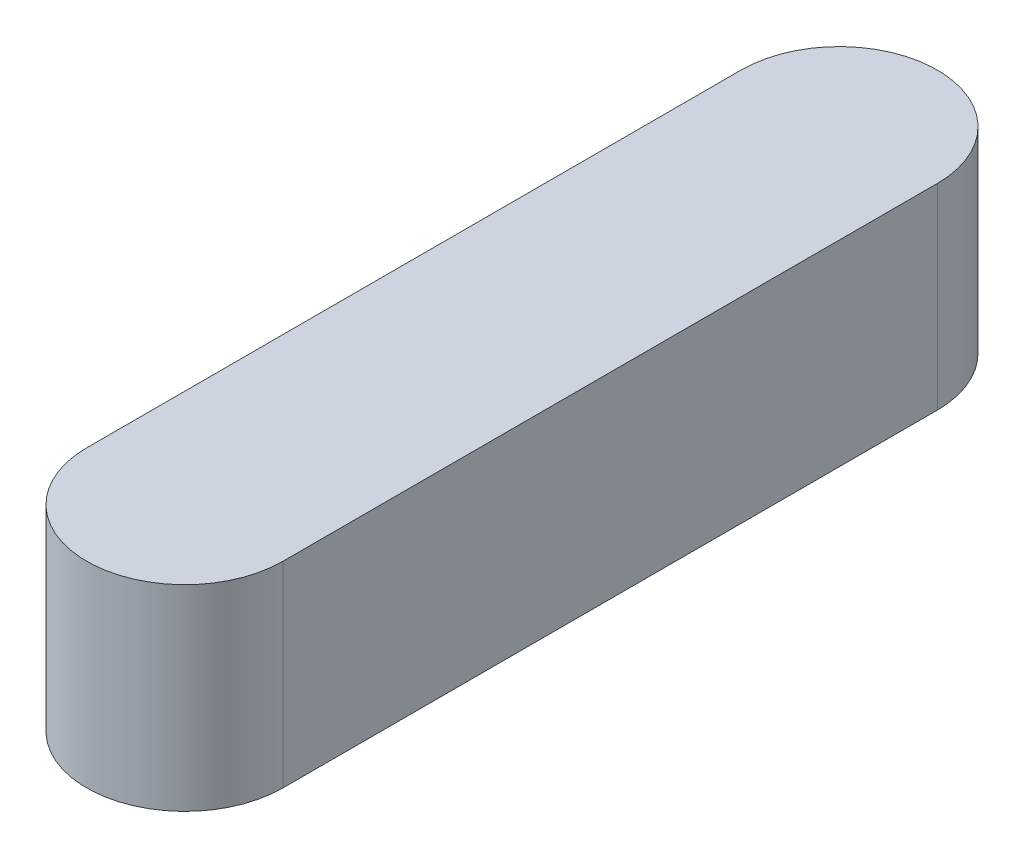
from build123d import *

# Parameters (mm, degrees)
BOSS_EXTRUDE1_DEPTH = 3


with BuildPart() as part:
    # Sketch1 → Boss-Extrude1 (new, symmetric)
    with BuildSketch(Plane(origin=(0, 0, 0), x_dir=(1, 0, 0), z_dir=(0, 1, 0))):
        with BuildLine():
            Line((-3, 10), (-3, -10))
            ThreePointArc((-3, -10), (0, -13), (3, -10))
            Line((3, -10), (3, 10))
            ThreePointArc((3, 10), (0, 13), (-3, 10))
        make_face()
    extrude(amount=BOSS_EXTRUDE1_DEPTH, both=True)


solid = part.part
